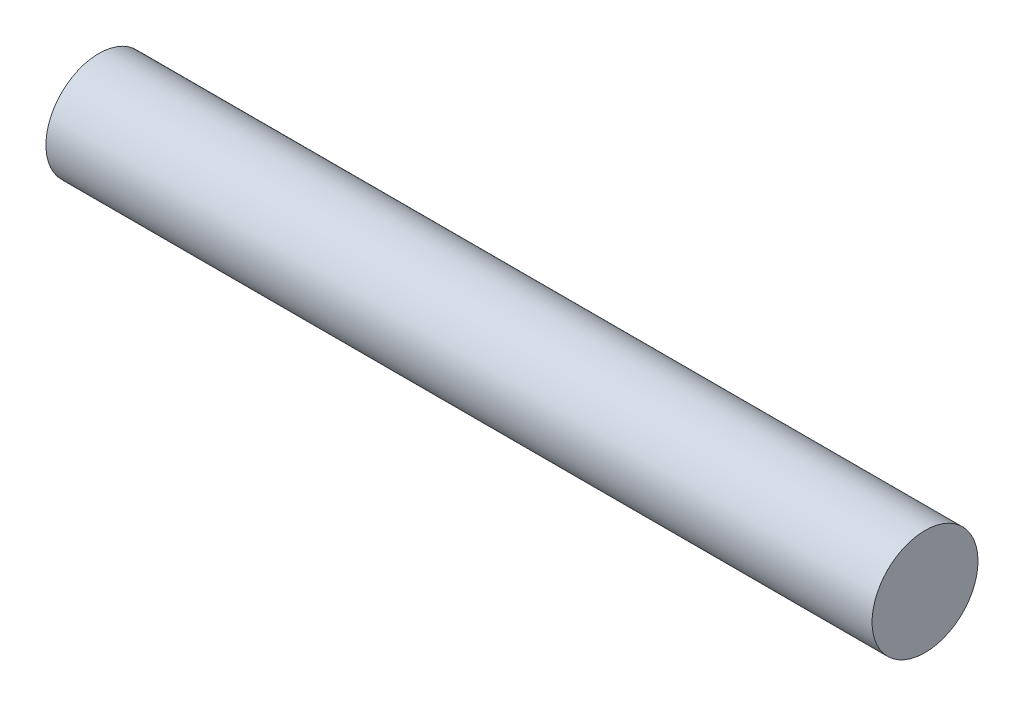
from build123d import *

# Parameters (mm, degrees)
SKETCH1_R           = 12.7
BOSS_EXTRUDE1_DEPTH = 198.12


with BuildPart() as part:
    # Sketch1 → Boss-Extrude1 (new body)
    with BuildSketch(Plane(origin=(0, 0, 0), x_dir=(0, 0, -1), z_dir=(1, 0, 0))):
        Circle(SKETCH1_R)
    extrude(amount=BOSS_EXTRUDE1_DEPTH)


solid = part.part
